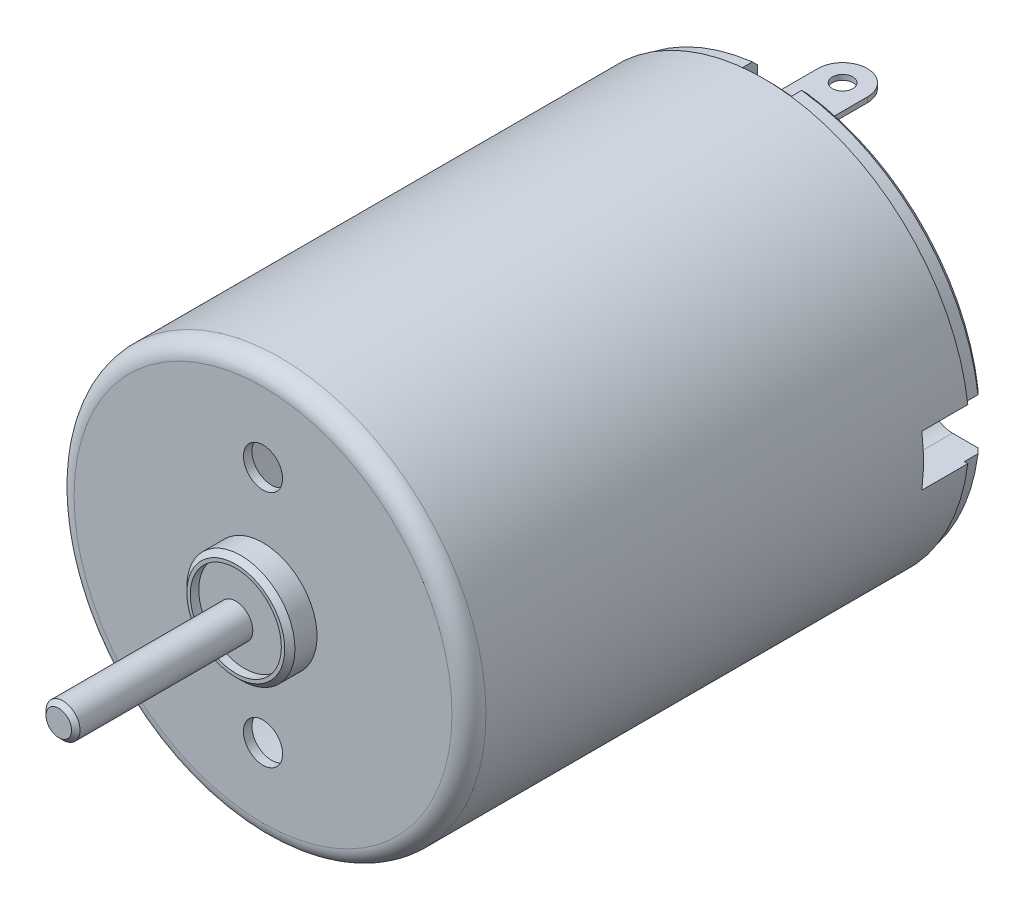
from build123d import *

# Parameters (mm, degrees)
SKETCH1_R                       = 12.1
BODY_DEPTH                      = 30.5
SKETCH2_R                       = 3.175
BOSS_EXTRUDE2_DEPTH             = 1.6
SKETCH3_R                       = 1
SHAFT_FRONT_DEPTH               = 10.4
SKETCH4_R                       = 4.25
BOSS_EXTRUDE5_DEPTH             = 2
SHAFT_REAR_START                = 0.5
SKETCH5_R                       = 1
SHAFT_REAR_DEPTH                = 0.5
SKETCH6_R                       = 1.15
CUT_EXTRUDE1_DEPTH              = 28.5
SKETCH7_R                       = 1
CUT_EXTRUDE2_DEPTH              = 28.5
CUT_EXTRUDE3_START              = -2
CUT_EXTRUDE3_DEPTH              = 2
SKETCH9_R                       = 12.1
SKETCH9_R_2                     = 11.9
CUT_EXTRUDE4_DEPTH              = 1.1
CHAMFER1_SIZE                   = 0.25
CUT_EXTRUDE5_DEPTH              = 0.9
CHAMFER2_SIZE                   = 0.3
FILLET1_R                       = 1
CUT_EXTRUDE6_DEPTH              = 3.8
SKETCH12_W                      = 2.9
SKETCH12_H                      = 0.3
CONNECTOR_1_DEPTH               = 5.9
FILLET2_RADIUS                  = 1.45
FILLET2_LENGTH                  = 0.3
SKETCH13_R                      = 0.6
CUT_EXTRUDE7_DEPTH              = 50.076292715
FILLET2_OF_CONNECTOR_2_2_RADIUS = 1.45
FILLET2_OF_CONNECTOR_2_2_LENGTH = 0.3
SKETCH14_R                      = 2.675
CUT_EXTRUDE8_DEPTH              = 0.5


with BuildPart() as part:
    # Sketch1 → Body (new body)
    with BuildSketch(Plane.XY):
        with Locations(Location((0, 0, 0), (0, 0, 180))):
            Circle(SKETCH1_R)
    extrude(amount=BODY_DEPTH)

    # Sketch2 → Boss-Extrude2 (add)
    with BuildSketch(Plane.XY.offset(30.5)):
        Circle(SKETCH2_R)
    extrude(amount=BOSS_EXTRUDE2_DEPTH)

    # Sketch3 → Shaft-front (add)
    with BuildSketch(Plane.XY.offset(32.1)):
        Circle(SKETCH3_R)
    extrude(amount=SHAFT_FRONT_DEPTH)

    # Sketch4 → Boss-Extrude5 (add)
    with BuildSketch(Plane(origin=(0, 0, 0), x_dir=(-1, 0, 0), z_dir=(0, 0, -1))):
        Circle(SKETCH4_R)
    extrude(amount=BOSS_EXTRUDE5_DEPTH)

    # Sketch5 → Shaft-rear (add)
    with BuildSketch(Plane(origin=(0, 0, -2), x_dir=(-1, 0, 0), z_dir=(0, 0, -1)).offset(SHAFT_REAR_START)):
        with Locations(Location((0, 0, 0), (0, 0, 180))):
            Circle(SKETCH5_R)
    extrude(amount=-SHAFT_REAR_DEPTH)

    # Sketch6 → Cut-Extrude1 (cut)
    with BuildSketch(Plane.XY.offset(30.5)):
        with Locations((0, 7)):
            Circle(SKETCH6_R)
        with Locations((0, -7)):
            Circle(SKETCH6_R)
    extrude(amount=-CUT_EXTRUDE1_DEPTH, mode=Mode.SUBTRACT)

    # Sketch7 → Cut-Extrude2 (cut)
    with BuildSketch(Plane(origin=(0, 0, 0), x_dir=(-1, 0, 0), z_dir=(0, 0, -1))):
        with Locations((-6.45, 0)):
            Circle(SKETCH7_R)
        with Locations((6.45, 0)):
            Circle(SKETCH7_R)
    extrude(amount=-CUT_EXTRUDE2_DEPTH, mode=Mode.SUBTRACT)

    # Sketch8 → Cut-Extrude3 (cut)
    with BuildSketch(Plane(origin=(0, 0, -2), x_dir=(-1, 0, 0), z_dir=(0, 0, -1)).offset(CUT_EXTRUDE3_START)):
        with BuildLine():
            Line((3.75, 2), (3.75, -2))
            ThreePointArc((3.75, -2), (4.25, 0), (3.75, 2))
        make_face()
    extrude(amount=CUT_EXTRUDE3_DEPTH, mode=Mode.SUBTRACT)

    # Sketch9 → Cut-Extrude4 (cut)
    with BuildSketch(Plane(origin=(0, 0, 0), x_dir=(-1, 0, 0), z_dir=(0, 0, -1))):
        Circle(SKETCH9_R)
        Circle(SKETCH9_R_2, mode=Mode.SUBTRACT)
    extrude(amount=-CUT_EXTRUDE4_DEPTH, mode=Mode.SUBTRACT)

    # Chamfer1
    chamfer1_edges = [part.edges().sort_by_distance(p)[0] for p in [
        (-1, 0, 42.5),
        (-1, 0, -2.5),
    ]]
    chamfer(chamfer1_edges, length=CHAMFER1_SIZE)

    # Sketch10 → Cut-Extrude5 (cut)
    with BuildSketch(Plane(origin=(0, 0, 0), x_dir=(-1, 0, 0), z_dir=(0, 0, -1))):
        with BuildLine():
            Line((0, -11.9), (0, -5.3))
            ThreePointArc((0, -5.3), (-3.001666204, -4.368065934), (-4.947726751, -1.9))
            Line((-4.947726751, -1.9), (-7.847726751, -1.9))
            ThreePointArc((-7.847726751, -1.9), (-5.544544717, -5.869824447), (-1.45, -7.943193007))
            Line((-1.45, -7.943193007), (-1.45, -11.811329307))
            ThreePointArc((-1.45, -11.811329307), (-0.726354337, -11.877811641), (0, -11.9))
        make_face()
        with BuildLine():
            ThreePointArc((1.45, -7.943193007), (5.544544717, -5.869824447), (7.847726751, -1.9))
            Line((7.847726751, -1.9), (4.947726751, -1.9))
            ThreePointArc((4.947726751, -1.9), (3.001666204, -4.368065934), (0, -5.3))
            Line((0, -5.3), (0, -11.9))
            ThreePointArc((0, -11.9), (0.726354337, -11.877811641), (1.45, -11.811329307))
            Line((1.45, -11.811329307), (1.45, -7.943193007))
        make_face()
    cut_extrude5 = extrude(amount=-CUT_EXTRUDE5_DEPTH, mode=Mode.SUBTRACT)

    # Chamfer2
    chamfer2_edges = [part.edges().sort_by_distance(p)[0] for p in [
        (4.25, 0, -2),
        (-3.75, 0, -2),
        (-3.175, 0, 32.1),
        (7.88527108, 8.912491234, 0),
    ]]
    chamfer(chamfer2_edges, length=CHAMFER2_SIZE)

    # Fillet1
    fillet1_edges = [part.edges().sort_by_distance(p)[0] for p in [
        (12.1, 0, 30.5),
    ]]
    fillet(fillet1_edges, radius=FILLET1_R)

    # Mirror1: Cut-Extrude5 across plane
    add(cut_extrude5.mirror(Plane.ZX), mode=Mode.SUBTRACT)

    # Sketch11 → Cut-Extrude6 (cut)
    with BuildSketch(Plane(origin=(0, 0, 0), x_dir=(-1, 0, 0), z_dir=(0, 0, -1))):
        with BuildLine():
            Line((-12.006664816, 1.5), (-10.006664816, 1.5))
            ThreePointArc((-10.006664816, 1.5), (-8.506664816, 0), (-10.006664816, -1.5))
            Line((-10.006664816, -1.5), (-12.006664816, -1.5))
            ThreePointArc((-12.006664816, -1.5), (-12.1, 0), (-12.006664816, 1.5))
        make_face()
    cut_extrude6 = extrude(amount=-CUT_EXTRUDE6_DEPTH, mode=Mode.SUBTRACT)

    # Mirror2: Cut-Extrude6 across plane
    add(cut_extrude6.mirror(Plane(origin=(0, 0, 0), x_dir=(0, 0, 1), z_dir=(1, 0, 0))), mode=Mode.SUBTRACT)

    # Sketch12 → Connector 1 (add)
    with BuildSketch(Plane(origin=(0, 0, 0.9), x_dir=(-1, 0, 0), z_dir=(0, 0, -1))):
        with Locations((0, -9.4)):
            Rectangle(SKETCH12_W, SKETCH12_H)
    connector_1 = extrude(amount=CONNECTOR_1_DEPTH)

    # Fillet2: full round fillet: the end face becomes a half cylinder, R = half its width
    fillet2_face = Plane((0, -9.4, -5), x_dir=(0, 1, 0), z_dir=(0, 0, -1))  # on the end face: x along it, z out of the body
    fillet2_slab = fillet2_face.offset(-FILLET2_RADIUS / 2) * Box(FILLET2_LENGTH, 2 * FILLET2_RADIUS, FILLET2_RADIUS, mode=Mode.PRIVATE)  # the body's end, R deep
    fillet2_round = Plane((0, -9.4, -3.55), x_dir=(0, 0, -1), z_dir=(0, 1, 0)) * Cylinder(FILLET2_RADIUS, FILLET2_LENGTH, mode=Mode.PRIVATE)  # its axis R under the face
    add(fillet2_slab - fillet2_round, mode=Mode.SUBTRACT)

    # Sketch13 → Cut-Extrude7 (cut, through all)
    with BuildSketch(Plane(origin=(0, -9.25, 0), x_dir=(1, 0, 0), z_dir=(0, 1, 0))):
        with Locations(Location((0, 3.55, 0), (0, 0, 270))):
            Circle(SKETCH13_R)
    cut_extrude7 = extrude(amount=-CUT_EXTRUDE7_DEPTH, mode=Mode.SUBTRACT)

    # Connector 2: Connector 1, Cut-Extrude7 across plane
    add(connector_1.mirror(Plane.ZX))
    add(cut_extrude7.mirror(Plane.ZX), mode=Mode.SUBTRACT)

    # Fillet2 of Connector 2 2: full round fillet: the end face becomes a half cylinder, R = half its width
    fillet2_of_connector_2_2_face = Plane((0, 9.4, -5), x_dir=(0, -1, 0), z_dir=(0, 0, -1))  # on the end face: x along it, z out of the body
    fillet2_of_connector_2_2_slab = fillet2_of_connector_2_2_face.offset(-FILLET2_OF_CONNECTOR_2_2_RADIUS / 2) * Box(FILLET2_OF_CONNECTOR_2_2_LENGTH, 2 * FILLET2_OF_CONNECTOR_2_2_RADIUS, FILLET2_OF_CONNECTOR_2_2_RADIUS, mode=Mode.PRIVATE)  # the body's end, R deep
    fillet2_of_connector_2_2_round = Plane((0, 9.4, -3.55), x_dir=(0, 0, -1), z_dir=(0, -1, 0)) * Cylinder(FILLET2_OF_CONNECTOR_2_2_RADIUS, FILLET2_OF_CONNECTOR_2_2_LENGTH, mode=Mode.PRIVATE)  # its axis R under the face
    add(fillet2_of_connector_2_2_slab - fillet2_of_connector_2_2_round, mode=Mode.SUBTRACT)

    # Sketch14 → Cut-Extrude8 (cut)
    with BuildSketch(Plane.XY.offset(32.1)):
        Circle(SKETCH14_R)
    extrude(amount=-CUT_EXTRUDE8_DEPTH, mode=Mode.SUBTRACT)


with BuildPart() as cut_extrude8_piece_1:
    # of the separate pieces the step leaves, piece 1, a body of its own (cut_extrude8_pieces)
    add(part.part.solids().sort_by_distance((-11.1, 0, 30.5))[0])

    # Sketch15 → Cut-Revolve1 (revolve, cut)
    with BuildSketch(Plane(origin=(0, 0, 0), x_dir=(1, 0, 0), z_dir=(0, 1, 0)), mode=Mode.PRIVATE) as cut_revolve1_sk:
        with BuildLine():
            Line((-11.6, -4.3), (0, -4.3))
            Line((0, -4.3), (0, -30))
            Line((0, -30), (-11.1, -30))
            ThreePointArc((-11.1, -30), (-11.453553391, -29.853553391), (-11.6, -29.5))
            Line((-11.6, -29.5), (-11.6, -4.3))
        make_face()
    revolve(cut_revolve1_sk.sketch.rotate(Axis((0, 0, 0), (0, 0, 1)), 352.878898083), axis=Axis((0, 0, 0), (0, 0, 1)), mode=Mode.SUBTRACT)


with BuildPart() as cut_extrude8_piece_2:
    # of the separate pieces the step leaves, piece 2, a body of its own (cut_extrude8_pieces)
    add(part.part.solids().sort_by_distance((1, 0, 42.25))[0])


solid = Compound([cut_extrude8_piece_1.part, cut_extrude8_piece_2.part])
